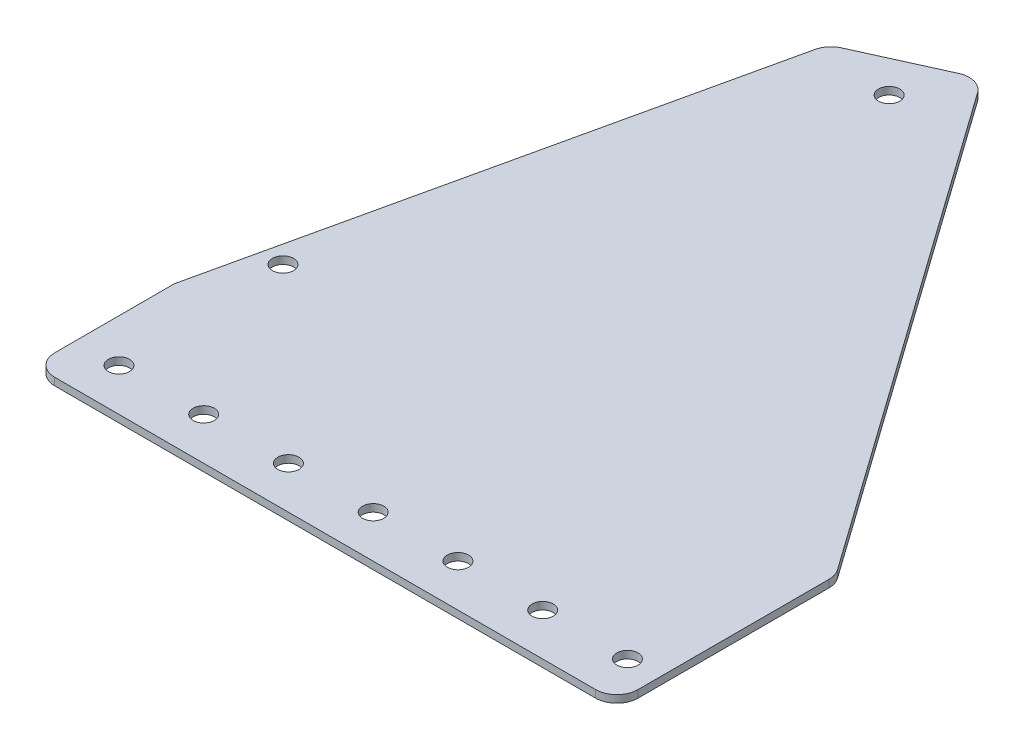
from build123d import *

# Parameters (mm, degrees)
SKETCH1_R           = 2
BOSS_EXTRUDE1_DEPTH = 1.4077243
FILLET2_R           = 4


with BuildPart() as part:
    # Sketch1 → Boss-Extrude1 (new body)
    with BuildSketch(Plane(origin=(0, 0, 0), x_dir=(1, 0, 0), z_dir=(0, 1, 0))):
        Polygon((6, -8), (6, 33.34843691), (-61.475760907, 128.370940703), (-81.524239093, 119.312324779), (-104.126855641, 18.58956294), (-104.126855641, -8), align=None)
        with Locations(Location((-96, 0, 0), (0, 0, 270))):
            Circle(SKETCH1_R, mode=Mode.SUBTRACT)
        with Locations(Location((-80, 0, 0), (0, 0, 270))):
            Circle(SKETCH1_R, mode=Mode.SUBTRACT)
        with Locations(Location((-64, 0, 0), (0, 0, 270))):
            Circle(SKETCH1_R, mode=Mode.SUBTRACT)
        with Locations(Location((-97.021679837, 31.983686003, 0), (0, 0, 270))):
            Circle(SKETCH1_R, mode=Mode.SUBTRACT)
        with Locations(Location((-48, 0, 0), (0, 0, 270))):
            Circle(SKETCH1_R, mode=Mode.SUBTRACT)
        with Locations(Location((-32, 0, 0), (0, 0, 270))):
            Circle(SKETCH1_R, mode=Mode.SUBTRACT)
        with Locations(Location((-16, 0, 0), (0, 0, 270))):
            Circle(SKETCH1_R, mode=Mode.SUBTRACT)
        with Locations(Location((0, 0, 0), (0, 0, 270))):
            Circle(SKETCH1_R, mode=Mode.SUBTRACT)
        with Locations(Location((-67.5, 116.913429511, 0), (0, 0, 270))):
            Circle(SKETCH1_R, mode=Mode.SUBTRACT)
    extrude(amount=BOSS_EXTRUDE1_DEPTH)

    # Fillet2
    fillet2_edges = [part.edges().sort_by_distance(p)[0] for p in [
        (6, 0.70386215, 8),
        (-104.126855641, 0.70386215, 8),
        (-104.126855641, 0.70386215, -18.58956294),
        (-81.524239093, 0.70386215, -119.312324779),
        (-61.475760907, 0.70386215, -128.370940703),
        (6, 0.70386215, -33.34843691),
    ]]
    fillet(fillet2_edges, radius=FILLET2_R)


solid = part.part
